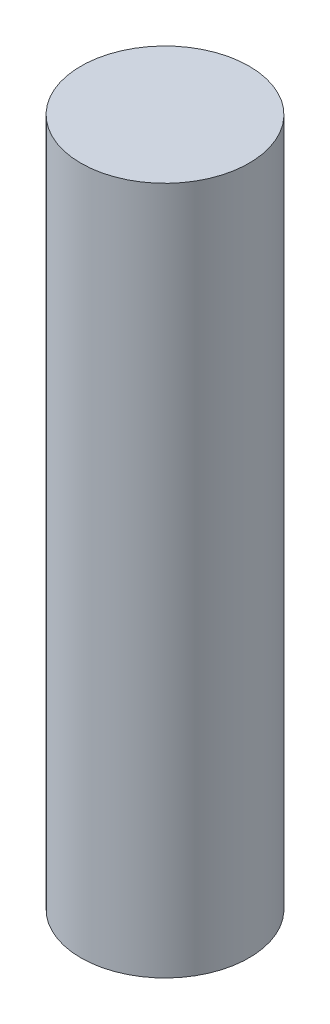
from build123d import *

# Parameters (mm, degrees)
SKETCH1_R           = 27.5
BOSS_EXTRUDE1_DEPTH = 225


with BuildPart() as part:
    # Sketch1 → Boss-Extrude1 (new body)
    with BuildSketch(Plane(origin=(0, 0, 0), x_dir=(1, 0, 0), z_dir=(0, 1, 0))):
        with Locations(Location((0, 0, 0), (0, 0, 270))):
            Circle(SKETCH1_R)
    extrude(amount=BOSS_EXTRUDE1_DEPTH)


solid = part.part
